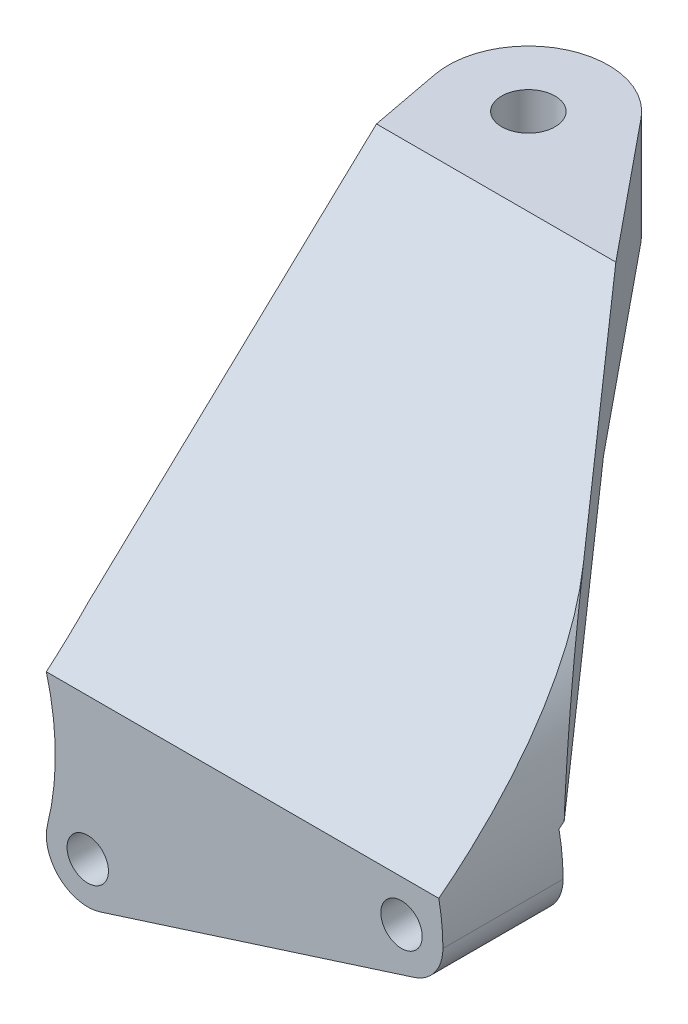
from build123d import *

# Parameters (mm, degrees)
SKETCH1_R            = 1.55
BOSS_EXTRUDE1_DEPTH  = 9
BOSS_EXTRUDE12_DEPTH = 17.39274351
SKETCH7_3_OUTSIDE_W  = 51.494
SKETCH7_3_OUTSIDE_H  = 57.894
SKETCH7_3_OUTSIDE_R  = 2
CUT_EXTRUDE3_DEPTH   = 17.39274351
CUT_EXTRUDE2_DEPTH   = 50
CUT_EXTRUDE5_DEPTH   = 58.797577804
CUT_EXTRUDE7_DEPTH   = 58.797577804


with BuildPart() as part:
    # Sketch1 → Boss-Extrude1 (new body)
    with BuildSketch(Plane.XY):
        with BuildLine():
            Line((26.6, 7.50725649), (26.6, 10.60725649))
            Line((26.6, 10.60725649), (-3.1, 10.60725649))
            Line((-3.1, 10.60725649), (-3.1, 0))
            ThreePointArc((-3.1, 0), (-1.828333755, -2.503436774), (0.943352052, -2.952979327))
            Line((0.943352052, -2.952979327), (24.443352052, 4.554277162))
            ThreePointArc((24.443352052, 4.554277162), (26.003436774, 5.678922735), (26.6, 7.50725649))
        make_face()
        Circle(SKETCH1_R, mode=Mode.SUBTRACT)
        with Locations((23.5, 7.50725649)):
            Circle(SKETCH1_R, mode=Mode.SUBTRACT)
    extrude(amount=-BOSS_EXTRUDE1_DEPTH)

    # Sketch7 → Boss-Extrude12 (add)
    with BuildSketch(Plane(origin=(0, 28, 0), x_dir=(1, 0, 0), z_dir=(0, 1, 0))):
        with BuildLine():
            Line((-3.1, 0), (-9.895228332, 35.883629581))
            ThreePointArc((-9.895228332, 35.883629581), (-6.533149103, 42.439039954), (0.648143683, 40.794042739))
            Line((0.648143683, 40.794042739), (26.6, 9))
            Line((26.6, 9), (26.6, 0))
            Line((26.6, 0), (-3.1, 0))
        make_face()
    extrude(amount=-BOSS_EXTRUDE12_DEPTH)

    # Sketch7<3> outside → Cut-Extrude3 (cut)
    # profile 1 of 2: a face of its own
    with BuildSketch(Plane(origin=(0, 28, 0), x_dir=(1, 0, 0), z_dir=(0, 1, 0))):
        with Locations((8.3, 21.5)):
            Rectangle(SKETCH7_3_OUTSIDE_W, SKETCH7_3_OUTSIDE_H)
        with BuildLine():
            Line((-3.1, 0), (-9.895228332, 35.883629581))
            ThreePointArc((-9.895228332, 35.883629581), (-6.533149103, 42.439039954), (0.648143683, 40.794042739))
            Line((0.648143683, 40.794042739), (26.6, 9))
            Line((26.6, 9), (26.6, 0))
            Line((26.6, 0), (-3.1, 0))
        make_face(mode=Mode.SUBTRACT)
    # profile 2 of 2: a face of its own
    with BuildSketch(Plane(origin=(0, 28, 0), x_dir=(1, 0, 0), z_dir=(0, 1, 0))):
        with Locations(Location((-4, 37, 0), (0, 0, 270))):
            Circle(SKETCH7_3_OUTSIDE_R)
    extrude(amount=-CUT_EXTRUDE3_DEPTH, mode=Mode.SUBTRACT)

    # Sketch8 → Cut-Extrude2 (cut, symmetric)
    with BuildSketch(Plane(origin=(0, 0, 0), x_dir=(0, 0, -1), z_dir=(1, 0, 0))):
        Polygon((0, 10.60725649), (30.5, 28), (0, 28), align=None)
        Polygon((43, 20), (25.471160912, 20), (9, 10.60725649), (43, 10.60725649), align=None)
    extrude(amount=CUT_EXTRUDE2_DEPTH, both=True, mode=Mode.SUBTRACT)

    # Sketch12 → Cut-Extrude5 (cut, through all)
    with BuildSketch(Plane.XY):
        with BuildLine():
            Line((-3.1, 0), (-7.493582912, 18.705566962))
            ThreePointArc((-7.493582912, 18.705566962), (-3.016370904, 10.284014045), (-3.008825552, 0.746303421))
            ThreePointArc((-3.008825552, 0.746303421), (-3.077121968, 0.375926049), (-3.1, 0))
        make_face()
    extrude(amount=-CUT_EXTRUDE5_DEPTH, mode=Mode.SUBTRACT)

    # Sketch14 → Cut-Extrude7 (cut, through all)
    with BuildSketch(Plane.XY):
        with BuildLine():
            Line((19.851500316, 20.45422786), (26.6, 15.73954146))
            Line((26.6, 15.73954146), (26.6, 7.50725649))
            ThreePointArc((26.6, 7.50725649), (24.811622249, 14.807364633), (19.851500316, 20.45422786))
        make_face()
    extrude(amount=-CUT_EXTRUDE7_DEPTH, mode=Mode.SUBTRACT)


solid = part.part
